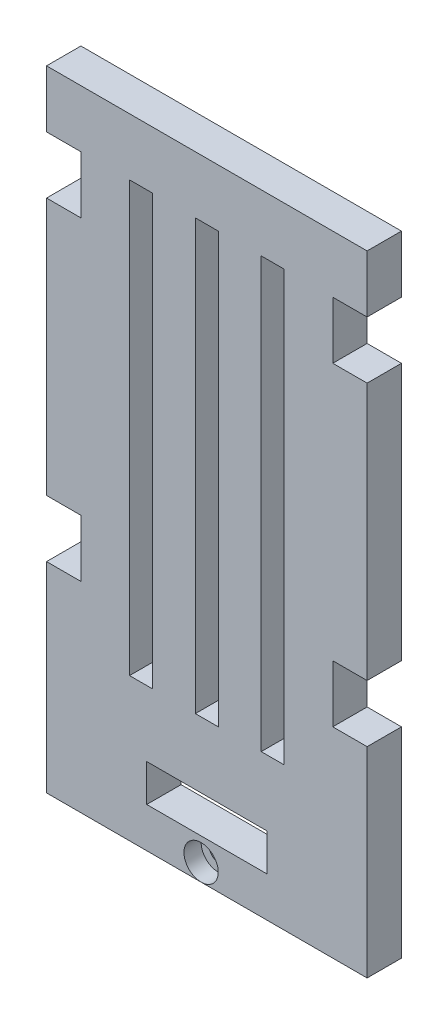
from build123d import *

# Parameters (mm, degrees)
ESQUISSE1_W             = 44
ESQUISSE1_H             = 110
BOSS_EXTRU_1_DEPTH      = 6
ESQUISSE2_W             = 21
ESQUISSE2_H             = 6.5
ESQUISSE2_W_2           = 4
ESQUISSE2_H_2           = 75
ENL_V_MAT_EXTRU_1_DEPTH = 6
ESQUISSE4_W             = 6
ESQUISSE4_H             = 10
ESQUISSE4_H_2           = 45
ESQUISSE4_H_3           = 35
BOSS_EXTRU_2_DEPTH      = 6
ESQUISSE6_R             = 1.5
ENL_V_MAT_EXTRU_3_DEPTH = 6
ESQUISSE8_R             = 2.995
ENL_V_MAT_EXTRU_4_DEPTH = 3


with BuildPart() as part:
    # Esquisse1 → Boss.-Extru.1 (new body)
    with BuildSketch(Plane.XY):
        with Locations((22, 55)):
            Rectangle(ESQUISSE1_W, ESQUISSE1_H)
    extrude(amount=BOSS_EXTRU_1_DEPTH)

    # Esquisse2 → Enlèv. mat.-Extru.1 (cut)
    with BuildSketch(Plane.XY.offset(6)):
        with Locations((22, 10.25)):
            Rectangle(ESQUISSE2_W, ESQUISSE2_H)
        with Locations((22, 62.5)):
            Rectangle(ESQUISSE2_W_2, ESQUISSE2_H_2)
        with Locations((33.5, 62.5)):
            Rectangle(ESQUISSE2_W_2, ESQUISSE2_H_2)
        with Locations((10.5, 62.5)):
            Rectangle(ESQUISSE2_W_2, ESQUISSE2_H_2)
    extrude(amount=-ENL_V_MAT_EXTRU_1_DEPTH, mode=Mode.SUBTRACT)

    # Esquisse4 → Boss.-Extru.2 (add)
    with BuildSketch(Plane.XY.offset(6)):
        with Locations((-3, 105)):
            Rectangle(ESQUISSE4_W, ESQUISSE4_H)
        with Locations((-3, 67.5)):
            Rectangle(ESQUISSE4_W, ESQUISSE4_H_2)
        with Locations((-3, 17.5)):
            Rectangle(ESQUISSE4_W, ESQUISSE4_H_3)
        with Locations((47, 17.5)):
            Rectangle(ESQUISSE4_W, ESQUISSE4_H_3)
        with Locations((47, 67.5)):
            Rectangle(ESQUISSE4_W, ESQUISSE4_H_2)
        with Locations((47, 105)):
            Rectangle(ESQUISSE4_W, ESQUISSE4_H)
    extrude(amount=-BOSS_EXTRU_2_DEPTH)

    # Esquisse6 → Enlèv. mat.-Extru.3 (cut)
    with BuildSketch(Plane.XY.offset(6)):
        with Locations((21, 3)):
            Circle(ESQUISSE6_R)
    extrude(amount=-ENL_V_MAT_EXTRU_3_DEPTH, mode=Mode.SUBTRACT)

    # Esquisse8 → Enlèv. mat.-Extru.4 (cut)
    with BuildSketch(Plane.XY.offset(6)):
        with Locations((21, 3)):
            Circle(ESQUISSE8_R)
    extrude(amount=-ENL_V_MAT_EXTRU_4_DEPTH, mode=Mode.SUBTRACT)


solid = part.part
